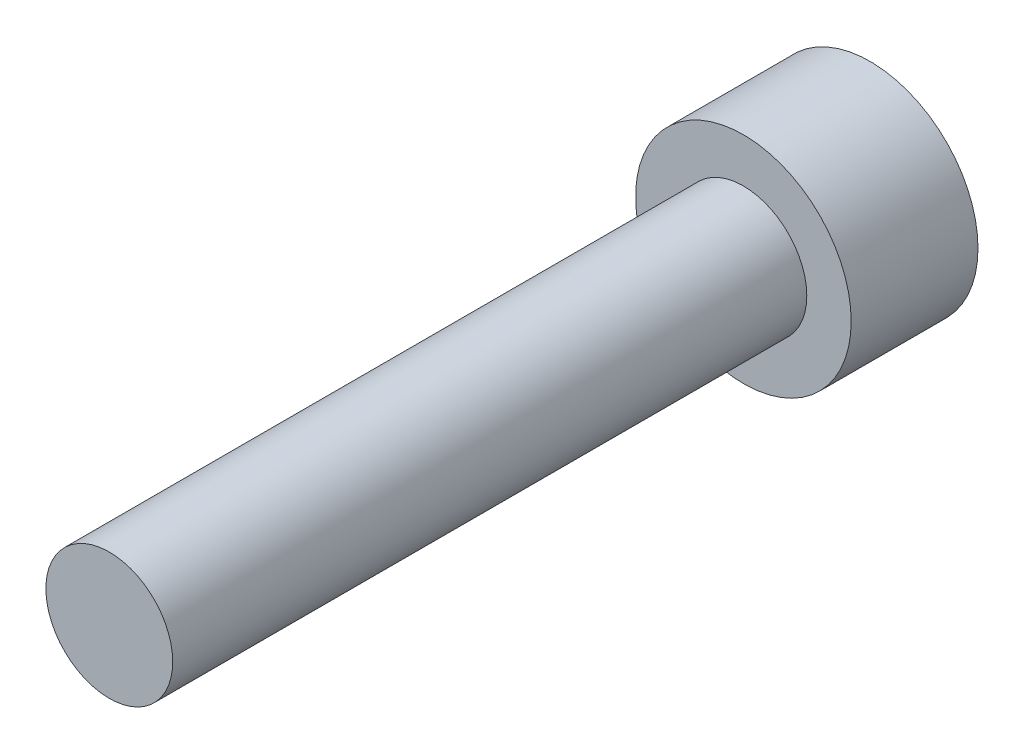
from build123d import *

# Parameters (mm, degrees)
SKETCH1_R           = 4.25
SKETCH1_R_2         = 2.5
BOSS_EXTRUDE3_DEPTH = 5
SKETCH1_3_R         = 2.5
BOSS_EXTRUDE4_DEPTH = 25


with BuildPart() as part:
    # Sketch1 → Boss-Extrude3 (new body)
    # profile 1 of 2: a face of its own
    with BuildSketch(Plane.XY):
        Circle(SKETCH1_R)
        Circle(SKETCH1_R_2, mode=Mode.SUBTRACT)
    # profile 2 of 2: a face of its own
    with BuildSketch(Plane.XY):
        Circle(SKETCH1_R_2)
    extrude(amount=-BOSS_EXTRUDE3_DEPTH)

    # Sketch1<3> → Boss-Extrude4 (add)
    with BuildSketch(Plane.XY):
        Circle(SKETCH1_3_R)
    extrude(amount=BOSS_EXTRUDE4_DEPTH)


solid = part.part
